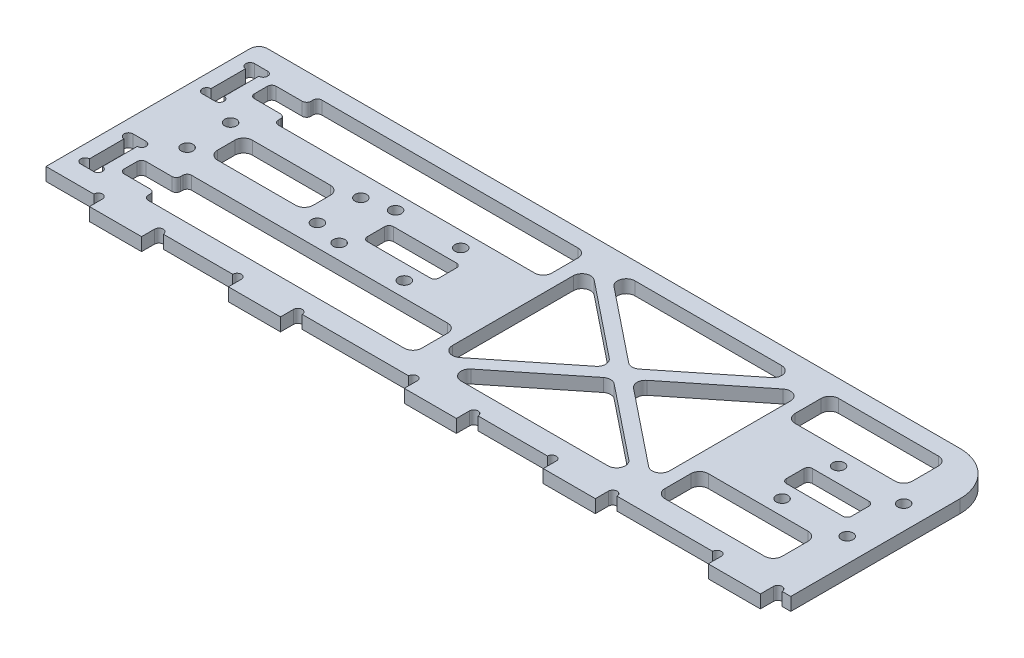
from build123d import *

# Parameters (mm, degrees)
SKETCH_1_W             = 160
SKETCH_1_H             = 48
SKETCH_1_W_2           = 62
SKETCH_1_H_2           = 10
SKETCH_1_W_3           = 16.5
SKETCH_1_H_3           = 6
SKETCH_1_W_4           = 27
SKETCH_1_W_5           = 15
EXTRUDE_1_DEPTH        = 3
SKETCH_2_R             = 1.35
CUT_EXTRUDE_1_DEPTH    = 84.576312434
SKETCH_3_W             = 160
SKETCH_3_H             = 1
EXTRUDE_2_DEPTH        = 3
SKETCH_5_W             = 5
SKETCH_5_H             = 49
EXTRUDE_4_DEPTH        = 3
SKETCH_6_W             = 8
SKETCH_6_H             = 5
CUT_EXTRUDE_2_DEPTH    = 89.651001122
SKETCH_7_W             = 12
SKETCH_7_H             = 3
EXTRUDE_5_DEPTH        = 3
EXTRUDE_6_DEPTH        = 3
SKETCH_8_R             = 1
CUT_EXTRUDE_3_DEPTH    = 96.735312189
SKETCH_12_R            = 1.35
CUT_EXTRUDE_6_DEPTH    = 96.735312189
SKETCH_11_W            = 22
SKETCH_11_H            = 8
CUT_EXTRUDE_5_DEPTH    = 96.735312189
CUT_EXTRUDE_6991_DEPTH = 96.735312189
FILLET_2_R             = 2
FILLET_1_R             = 1
FILLET_3_R             = 10
FILLET_4_R             = 2


with BuildPart() as part:
    # 草图1 → 凸台-拉伸1 (new body)
    with BuildSketch(Plane(origin=(0, 0, 0), x_dir=(1, 0, 0), z_dir=(0, 1, 0))):
        Rectangle(SKETCH_1_W, SKETCH_1_H)
        with Locations((-43, -15)):
            Rectangle(SKETCH_1_W_2, SKETCH_1_H_2, mode=Mode.SUBTRACT)
        with Locations((-43, 15)):
            Rectangle(SKETCH_1_W_2, SKETCH_1_H_2, mode=Mode.SUBTRACT)
        with Locations((-32.25, 0)):
            Rectangle(SKETCH_1_W_3, SKETCH_1_H_3, mode=Mode.SUBTRACT)
        with Locations((57.5, -15)):
            Rectangle(SKETCH_1_W_4, SKETCH_1_H_2, mode=Mode.SUBTRACT)
        with Locations((57.5, 15)):
            Rectangle(SKETCH_1_W_4, SKETCH_1_H_2, mode=Mode.SUBTRACT)
        with Locations((63.5, 0)):
            Rectangle(SKETCH_1_W_5, SKETCH_1_H_3, mode=Mode.SUBTRACT)
    extrude(amount=EXTRUDE_1_DEPTH)

    # 草图2 → 切除-拉伸1 (cut, through all)
    with BuildSketch(Plane(origin=(0, 3, 0), x_dir=(1, 0, 0), z_dir=(0, 1, 0))):
        with Locations(Location((74.5, 6.5, 0), (0, 0, 270))):
            Circle(SKETCH_2_R)
        with Locations(Location((59.5, 6.5, 0), (0, 0, 90))):
            Circle(SKETCH_2_R)
        with Locations(Location((59.5, -6.5, 0), (0, 0, 270))):
            Circle(SKETCH_2_R)
        with Locations(Location((74.5, -6.5, 0), (0, 0, 90))):
            Circle(SKETCH_2_R)
        with Locations(Location((-42.5, -6.5, 0), (0, 0, 270))):
            Circle(SKETCH_2_R)
        with Locations(Location((-27.5, -6.5, 0), (0, 0, 90))):
            Circle(SKETCH_2_R)
        with Locations(Location((-27.5, 6.5, 0), (0, 0, 270))):
            Circle(SKETCH_2_R)
        with Locations(Location((-42.5, 6.5, 0), (0, 0, 90))):
            Circle(SKETCH_2_R)
    extrude(amount=-CUT_EXTRUDE_1_DEPTH, mode=Mode.SUBTRACT)

    # 草图3 → 凸台-拉伸2 (add)
    with BuildSketch(Plane(origin=(0, 3, 0), x_dir=(1, 0, 0), z_dir=(0, 1, 0))):
        with Locations((0, -24.5)):
            Rectangle(SKETCH_3_W, SKETCH_3_H)
    extrude(amount=-EXTRUDE_2_DEPTH)

    # 草图5 → 凸台-拉伸4 (add)
    with BuildSketch(Plane(origin=(0, 3, 0), x_dir=(1, 0, 0), z_dir=(0, 1, 0))):
        with Locations((-82.5, -0.5)):
            Rectangle(SKETCH_5_W, SKETCH_5_H)
    extrude(amount=-EXTRUDE_4_DEPTH)

    # 草图6 → 切除-拉伸2 (cut, through all)
    with BuildSketch(Plane(origin=(0, 3, 0), x_dir=(1, 0, 0), z_dir=(0, 1, 0))):
        with Locations((-78, -15)):
            Rectangle(SKETCH_6_W, SKETCH_6_H)
        with Locations((-78, 15)):
            Rectangle(SKETCH_6_W, SKETCH_6_H)
    extrude(amount=-CUT_EXTRUDE_2_DEPTH, mode=Mode.SUBTRACT)

    # 草图7 → 凸台-拉伸5 (add)
    with BuildSketch(Plane(origin=(0, 3, 0), x_dir=(1, 0, 0), z_dir=(0, 1, 0))):
        with Locations((70, -26.5)):
            Rectangle(SKETCH_7_W, SKETCH_7_H)
        with Locations((0, -26.5)):
            Rectangle(SKETCH_7_W, SKETCH_7_H)
        with Locations((32, -26.5)):
            Rectangle(SKETCH_7_W, SKETCH_7_H)
        with Locations((-72.5, -26.5)):
            Rectangle(SKETCH_7_W, SKETCH_7_H)
        with Locations((-40.5, -26.5)):
            Rectangle(SKETCH_7_W, SKETCH_7_H)
    extrude(amount=-EXTRUDE_5_DEPTH)

    # 草图9 → 凸台-拉伸6 (add)
    with BuildSketch(Plane(origin=(0, 3, 0), x_dir=(1, 0, 0), z_dir=(0, 1, 0))):
        Polygon((-85, -25), (-85, -20.5), (-88, -20.5), (-88, -8.5), (-85, -8.5), (-85, 7.5), (-88, 7.5), (-88, 19.5), (-85, 19.5), (-85, 24), (-91.5, 24), (-91.5, -25), align=None)
    extrude(amount=-EXTRUDE_6_DEPTH)

    # 草图8 → 切除-拉伸3 (cut, through all)
    with BuildSketch(Plane(origin=(0, 3, 0), x_dir=(1, 0, 0), z_dir=(0, 1, 0))):
        with Locations((63, -25)):
            Circle(SKETCH_8_R)
        with Locations((77, -25)):
            Circle(SKETCH_8_R)
        with Locations((39, -25)):
            Circle(SKETCH_8_R)
        with Locations((25, -25)):
            Circle(SKETCH_8_R)
        with Locations((7, -25)):
            Circle(SKETCH_8_R)
        with Locations((-7, -25)):
            Circle(SKETCH_8_R)
        with Locations((-33.5, -25)):
            Circle(SKETCH_8_R)
        with Locations((-47.5, -25)):
            Circle(SKETCH_8_R)
        with Locations((-65.5, -25)):
            Circle(SKETCH_8_R)
        with Locations((-79.5, -25)):
            Circle(SKETCH_8_R)
        with Locations((-85, -19.5)):
            Circle(SKETCH_8_R)
        with Locations((-88, -19.5)):
            Circle(SKETCH_8_R)
        with Locations((-88, -9.5)):
            Circle(SKETCH_8_R)
        with Locations((-85, -9.5)):
            Circle(SKETCH_8_R)
        with Locations((-85, 8.5)):
            Circle(SKETCH_8_R)
        with Locations((-88, 8.5)):
            Circle(SKETCH_8_R)
        with Locations((-88, 18.5)):
            Circle(SKETCH_8_R)
        with Locations((-85, 18.5)):
            Circle(SKETCH_8_R)
    extrude(amount=-CUT_EXTRUDE_3_DEPTH, mode=Mode.SUBTRACT)

    # 草图12 → 切除-拉伸6 (cut, through all)
    with BuildSketch(Plane(origin=(0, 3, 0), x_dir=(1, 0, 0), z_dir=(0, 1, 0))):
        with Locations(Location((-79, -5, 0), (0, 0, 270))):
            Circle(SKETCH_12_R)
        with Locations(Location((-79, 5, 0), (0, 0, 270))):
            Circle(SKETCH_12_R)
        with Locations(Location((-49, 5, 0), (0, 0, 270))):
            Circle(SKETCH_12_R)
        with Locations(Location((-49, -5, 0), (0, 0, 270))):
            Circle(SKETCH_12_R)
    extrude(amount=-CUT_EXTRUDE_6_DEPTH, mode=Mode.SUBTRACT)

    # 草图11 → 切除-拉伸5 (cut, through all)
    with BuildSketch(Plane(origin=(0, 3, 0), x_dir=(1, 0, 0), z_dir=(0, 1, 0))):
        Polygon((38.598828411, -20), (16, -1.920937271), (-6.598828411, -20), align=None)
        Polygon((41, -18.079062729), (41, 18.079062729), (18.401171589, 0), align=None)
        Polygon((16, 1.920937271), (-6.598828411, 20), (38.598828411, 20), align=None)
        Polygon((-9, 18.079062729), (13.598828411, 0), (-9, -18.079062729), align=None)
        with Locations((-64, 0)):
            Rectangle(SKETCH_11_W, SKETCH_11_H)
    extrude(amount=-CUT_EXTRUDE_5_DEPTH, mode=Mode.SUBTRACT)

    # 草图13 → Cut-Extrude 6991 (cut, through all)
    with BuildSketch(Plane(origin=(0, 3, 0), x_dir=(1, 0, 0), z_dir=(0, 1, 0))):
        with BuildLine():
            Line((-84.98, -18.480196097), (-84.98, -10.519803903))
            ThreePointArc((-84.98, -10.519803903), (-83.980049025, -9.489999519), (-85, -8.48))
            Line((-85, -8.48), (-88, -8.48))
            ThreePointArc((-88, -8.48), (-89.019950975, -9.489999519), (-88.02, -10.519803903))
            Line((-88.02, -10.519803903), (-88.02, -18.480196097))
            ThreePointArc((-88.02, -18.480196097), (-89.019950975, -19.510000481), (-88, -20.52))
            Line((-88, -20.52), (-85, -20.52))
            ThreePointArc((-85, -20.52), (-83.980049025, -19.510000481), (-84.98, -18.480196097))
        make_face()
        with BuildLine():
            Line((-88, 19.52), (-85, 19.52))
            ThreePointArc((-85, 19.52), (-83.980049025, 18.510000481), (-84.98, 17.480196097))
            Line((-84.98, 17.480196097), (-84.98, 9.519803903))
            ThreePointArc((-84.98, 9.519803903), (-83.980049025, 8.489999519), (-85, 7.48))
            Line((-85, 7.48), (-88, 7.48))
            ThreePointArc((-88, 7.48), (-89.019950975, 8.489999519), (-88.02, 9.519803903))
            Line((-88.02, 9.519803903), (-88.02, 17.480196097))
            ThreePointArc((-88.02, 17.480196097), (-89.019950975, 18.510000481), (-88, 19.52))
        make_face()
    extrude(amount=-CUT_EXTRUDE_6991_DEPTH, mode=Mode.SUBTRACT)

    # 圆角2
    fillet_2_edges = [part.edges().sort_by_distance(p)[0] for p in [
        (-12, 1.5, -10),
        (-12, 1.5, -20),
        (-12, 1.5, 20),
        (-12, 1.5, 10),
        (71, 1.5, -10),
        (71, 1.5, -20),
        (44, 1.5, -20),
        (44, 1.5, -10),
        (71, 1.5, 20),
        (71, 1.5, 10),
        (44, 1.5, 10),
        (44, 1.5, 20),
    ]]
    fillet(fillet_2_edges, radius=FILLET_2_R)

    # 圆角1
    fillet_1_edges = [part.edges().sort_by_distance(p)[0] for p in [
        (-74, 1.5, -20),
        (-74, 1.5, -10),
        (-74, 1.5, 12.5),
        (-74, 1.5, 17.5),
        (-82, 1.5, 17.5),
        (-82, 1.5, 12.5),
        (-74, 1.5, -17.5),
        (-74, 1.5, -12.5),
        (-82, 1.5, -12.5),
        (-82, 1.5, -17.5),
        (-40.5, 1.5, -3),
        (-40.5, 1.5, 3),
        (-24, 1.5, 3),
        (-24, 1.5, -3),
        (71, 1.5, 3),
        (71, 1.5, -3),
        (56, 1.5, -3),
        (56, 1.5, 3),
        (-74, 1.5, 10),
        (-74, 1.5, 20),
    ]]
    fillet(fillet_1_edges, radius=FILLET_1_R)

    # 圆角3
    fillet_3_edges = [part.edges().sort_by_distance(p)[0] for p in [
        (80, 1.5, -24),
    ]]
    fillet(fillet_3_edges, radius=FILLET_3_R)

    # 圆角4
    fillet_4_edges = [part.edges().sort_by_distance(p)[0] for p in [
        (-91.5, 1.5, -24),
        (38.598828411, 1.5, -20),
        (16, 1.5, -1.920937271),
        (-6.598828411, 1.5, -20),
        (41, 1.5, 18.079062729),
        (18.401171589, 1.5, 0),
        (41, 1.5, -18.079062729),
        (-9, 1.5, 18.079062729),
        (-9, 1.5, -18.079062729),
        (13.598828411, 1.5, 0),
        (-53, 1.5, -4),
        (-53, 1.5, 4),
        (-75, 1.5, 4),
        (-75, 1.5, -4),
        (38.598828411, 1.5, 20),
        (-6.598828411, 1.5, 20),
        (16, 1.5, 1.920937271),
    ]]
    fillet(fillet_4_edges, radius=FILLET_4_R)


solid = part.part
